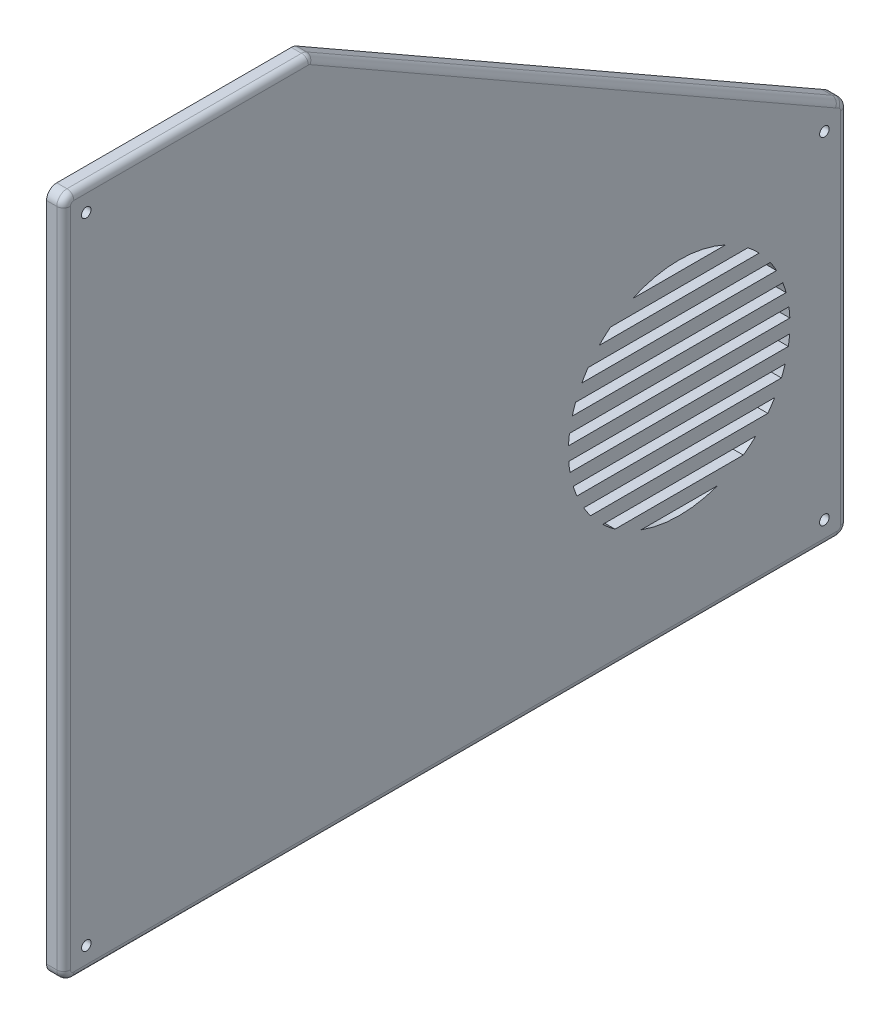
from build123d import *

# Parameters (mm, degrees)
SKETCH2_R           = 1.4
SKETCH2_R_2         = 1.414097505
BOSS_EXTRUDE2_DEPTH = 5
CUT_EXTRUDE1_DEPTH  = 5
FILLET4_R           = 2


with BuildPart() as part:
    # Sketch2 → Boss-Extrude2 (new body)
    with BuildSketch(Plane(origin=(0, 0, 0), x_dir=(0, 0, -1), z_dir=(1, 0, 0))):
        with BuildLine():
            Line((-137.05346623, 114.041314814), (-137.05346623, -79.958685186))
            ThreePointArc((-137.05346623, -79.958685186), (-136.174786573, -82.08000553), (-134.05346623, -82.958685186))
            Line((-134.05346623, -82.958685186), (89.94653377, -82.958685186))
            ThreePointArc((89.94653377, -82.958685186), (92.067854114, -82.08000553), (92.94653377, -79.958685186))
            Line((92.94653377, -79.958685186), (92.94653377, 25.368162352))
            ThreePointArc((92.94653377, 25.368162352), (92.541535124, 26.8734756), (91.435888454, 27.97235563))
            Line((91.435888454, 27.97235563), (90.428791577, 28.548320734))
            Line((90.428791577, 28.548320734), (-63.7480103, 116.646068127))
            ThreePointArc((-63.7480103, 116.646068127), (-64.466404774, 116.940819939), (-65.236385313, 117.041314814))
            Line((-65.236385313, 117.041314814), (-134.05346623, 117.041314814))
            ThreePointArc((-134.05346623, 117.041314814), (-136.174786573, 116.162635157), (-137.05346623, 114.041314814))
        make_face()
        with Locations((-130.402194721, 110.164268622)):
            Circle(SKETCH2_R, mode=Mode.SUBTRACT)
        with Locations((-130.378834203, -76.102450402)):
            Circle(SKETCH2_R, mode=Mode.SUBTRACT)
        with Locations((86.178766817, -76.190918233)):
            Circle(SKETCH2_R_2, mode=Mode.SUBTRACT)
        with Locations((86.178766817, 22.440231448)):
            Circle(SKETCH2_R, mode=Mode.SUBTRACT)
    extrude(amount=BOSS_EXTRUDE2_DEPTH)

    # Sketch3 → Cut-Extrude1 (cut)
    with BuildSketch(Plane(origin=(5, 0, 0), x_dir=(0, 0, -1), z_dir=(1, 0, 0))):
        with BuildLine():
            ThreePointArc((43.568031387, 11.142105509), (36.585911365, 10.383246006), (29.92984969, 8.142105509))
            Line((29.92984969, 8.142105509), (57.206213084, 8.142105509))
            ThreePointArc((57.206213084, 8.142105509), (50.550151409, 10.383246006), (43.568031387, 11.142105509))
        make_face()
        with BuildLine():
            ThreePointArc((23.418589707, 4.142105509), (21.715728373, 2.69884787), (20.115952588, 1.142105509))
            Line((20.115952588, 1.142105509), (67.020110186, 1.142105509))
            ThreePointArc((67.020110186, 1.142105509), (65.420334401, 2.69884787), (63.717473066, 4.142105509))
            Line((63.717473066, 4.142105509), (23.418589707, 4.142105509))
        make_face()
        with BuildLine():
            Line((70.288809819, -2.857894491), (16.847252955, -2.857894491))
            ThreePointArc((16.847252955, -2.857894491), (15.884118126, -4.332885047), (15.002317673, -5.857894491))
            Line((15.002317673, -5.857894491), (72.133745101, -5.857894491))
            ThreePointArc((72.133745101, -5.857894491), (71.251944648, -4.332885047), (70.288809819, -2.857894491))
        make_face()
        with BuildLine():
            Line((73.965399694, -9.857894491), (13.17066308, -9.857894491))
            ThreePointArc((13.17066308, -9.857894491), (12.648553826, -11.346106069), (12.199257104, -12.857894491))
            Line((12.199257104, -12.857894491), (74.93680567, -12.857894491))
            ThreePointArc((74.93680567, -12.857894491), (74.487508947, -11.346106069), (73.965399694, -9.857894491))
        make_face()
        with BuildLine():
            Line((75.754985266, -16.857894491), (11.381077508, -16.857894491))
            ThreePointArc((11.381077508, -16.857894491), (11.207088544, -18.354666502), (11.102665225, -19.857894491))
            Line((11.102665225, -19.857894491), (76.033397548, -19.857894491))
            ThreePointArc((76.033397548, -19.857894491), (75.928974229, -18.354666502), (75.754985266, -16.857894491))
        make_face()
        with BuildLine():
            Line((75.971734879, -23.857894491), (11.164327895, -23.857894491))
            ThreePointArc((11.164327895, -23.857894491), (11.315662222, -25.362227549), (11.536796631, -26.857894491))
            Line((11.536796631, -26.857894491), (75.599266143, -26.857894491))
            ThreePointArc((75.599266143, -26.857894491), (75.820400552, -25.362227549), (75.971734879, -23.857894491))
        make_face()
        with BuildLine():
            Line((74.648571923, -30.857894491), (12.487490851, -30.857894491))
            ThreePointArc((12.487490851, -30.857894491), (12.990946698, -32.371154315), (13.568031387, -33.857894491))
            Line((13.568031387, -33.857894491), (73.568031387, -33.857894491))
            ThreePointArc((73.568031387, -33.857894491), (74.145116075, -32.371154315), (74.648571923, -30.857894491))
        make_face()
        with BuildLine():
            Line((71.568031387, -37.857894491), (15.568031387, -37.857894491))
            ThreePointArc((15.568031387, -37.857894491), (16.526396821, -39.385650868), (17.568031387, -40.857894491))
            Line((17.568031387, -40.857894491), (69.568031387, -40.857894491))
            ThreePointArc((69.568031387, -40.857894491), (70.609665953, -39.385650868), (71.568031387, -37.857894491))
        make_face()
        with BuildLine():
            Line((66.017975707, -44.857894491), (21.118087066, -44.857894491))
            ThreePointArc((21.118087066, -44.857894491), (22.881161375, -46.423875603), (24.753143665, -47.857894491))
            Line((24.753143665, -47.857894491), (62.382919109, -47.857894491))
            ThreePointArc((62.382919109, -47.857894491), (64.254901399, -46.423875603), (66.017975707, -44.857894491))
        make_face()
        with BuildLine():
            Line((54.793003547, -51.857894491), (32.343059226, -51.857894491))
            ThreePointArc((32.343059226, -51.857894491), (43.568031387, -53.857894491), (54.793003547, -51.857894491))
        make_face()
    extrude(amount=-CUT_EXTRUDE1_DEPTH, mode=Mode.SUBTRACT)

    # Fillet4
    fillet4_edges = [part.edges().sort_by_distance(p)[0] for p in [
        (5, -82.08000553, 136.174786573),
        (5, -82.958685186, 22.05346623),
        (5, -82.08000553, -92.067854114),
        (5, -27.295261417, -92.94653377),
        (5, 26.8734756, -92.541535124),
        (5, 28.260338182, -90.932340015),
        (5, 72.59719443, -13.340390638),
        (5, 116.940819939, 64.466404774),
        (5, 117.041314814, 99.644925771),
        (5, 116.162635157, 136.174786573),
        (5, 17.041314814, 137.05346623),
    ]]
    fillet(fillet4_edges, radius=FILLET4_R)


solid = part.part
